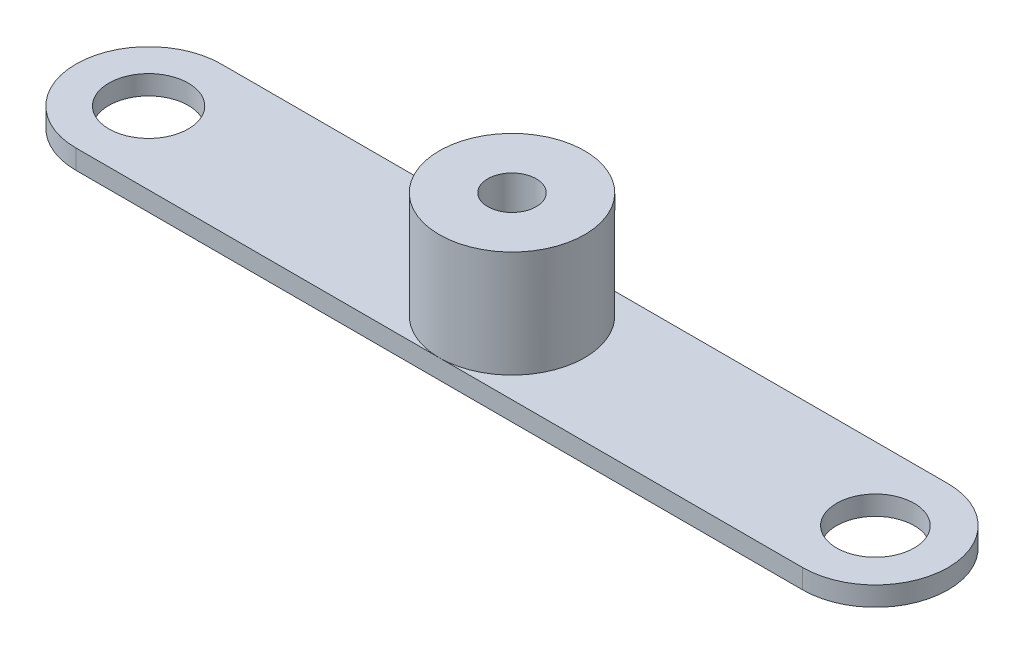
from build123d import *

# Parameters (mm, degrees)
SKETCH1_R           = 4.1
SKETCH1_R_2         = 4
BOSS_EXTRUDE1_DEPTH = 2
SKETCH3_R           = 7.5
BOSS_EXTRUDE3_DEPTH = 11
SKETCH4_R           = 2.5
CUT_EXTRUDE1_DEPTH  = 48.436800061


with BuildPart() as part:
    # Sketch1 → Boss-Extrude1 (new body)
    with BuildSketch(Plane(origin=(0, 0, 0), x_dir=(1, 0, 0), z_dir=(0, 1, 0))):
        with BuildLine():
            Line((-37.5, 7.5), (37.5, 7.5))
            ThreePointArc((37.5, 7.5), (45, 0), (37.5, -7.5))
            Line((37.5, -7.5), (-37.5, -7.5))
            ThreePointArc((-37.5, -7.5), (-45, 0), (-37.5, 7.5))
        make_face()
        with Locations(Location((-37.5, 0, 0), (0, 0, 270))):
            Circle(SKETCH1_R, mode=Mode.SUBTRACT)
        with Locations(Location((37.5, 0, 0), (0, 0, 270))):
            Circle(SKETCH1_R_2, mode=Mode.SUBTRACT)
    extrude(amount=BOSS_EXTRUDE1_DEPTH)

    # Sketch3 → Boss-Extrude3 (add)
    with BuildSketch(Plane(origin=(0, 2, 0), x_dir=(1, 0, 0), z_dir=(0, 1, 0))):
        with Locations(Location((0, 0, 0), (0, 0, 270))):
            Circle(SKETCH3_R)
    extrude(amount=BOSS_EXTRUDE3_DEPTH)

    # Sketch4 → Cut-Extrude1 (cut, through all)
    with BuildSketch(Plane(origin=(0, 13, 0), x_dir=(1, 0, 0), z_dir=(0, 1, 0))):
        with Locations(Location((0, 0, 0), (0, 0, 270))):
            Circle(SKETCH4_R)
    extrude(amount=-CUT_EXTRUDE1_DEPTH, mode=Mode.SUBTRACT)


solid = part.part
